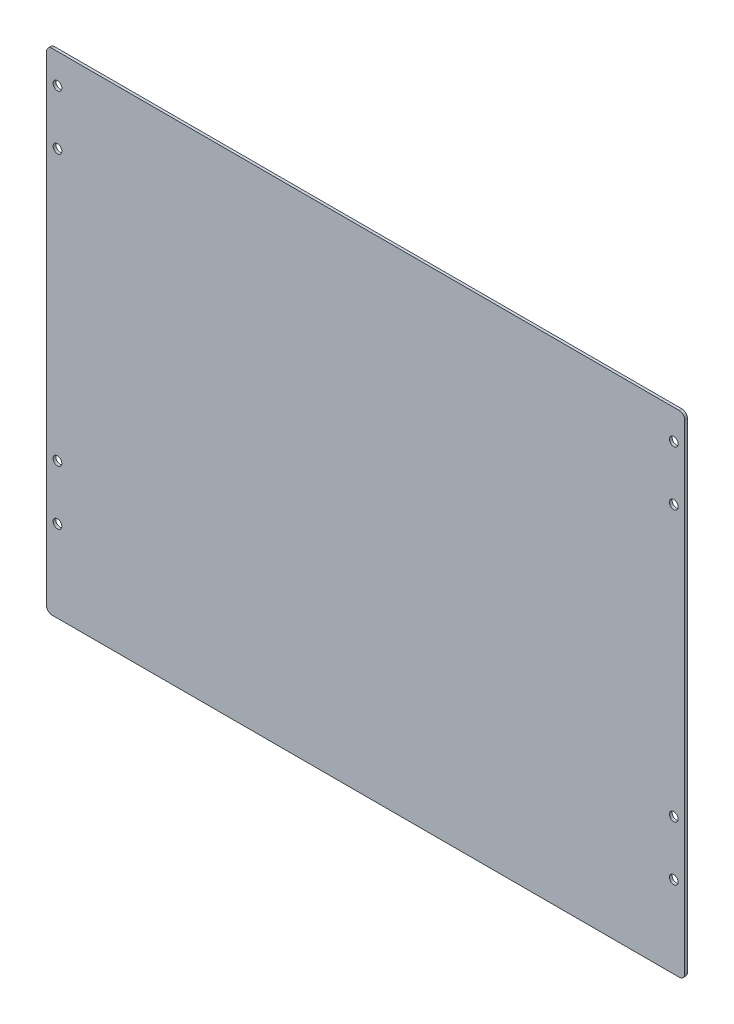
from build123d import *

# Parameters (mm, degrees)
SKETCH_1_W          = 234
SKETCH_1_H          = 180
EXTRUDE_1_DEPTH     = 1
SKETCH_2_R          = 1.6
CUT_EXTRUDE_1_DEPTH = 10
FILLET_1_R          = 2


with BuildPart() as part:
    # 草图1 → 凸台-拉伸1 (new body)
    with BuildSketch(Plane.XY):
        Rectangle(SKETCH_1_W, SKETCH_1_H)
    extrude(amount=EXTRUDE_1_DEPTH)

    # 草图2 → 切除-拉伸1 (cut)
    with BuildSketch(Plane.XY.offset(1)):
        with Locations((-113, -60)):
            Circle(SKETCH_2_R)
        with Locations((-113, -40)):
            Circle(SKETCH_2_R)
        with Locations((-113, 59.12)):
            Circle(SKETCH_2_R)
        with Locations((-113, 79.12)):
            Circle(SKETCH_2_R)
        with Locations((113, -60)):
            Circle(SKETCH_2_R)
        with Locations((113, -40)):
            Circle(SKETCH_2_R)
        with Locations((113, 59.12)):
            Circle(SKETCH_2_R)
        with Locations((113, 79.12)):
            Circle(SKETCH_2_R)
    extrude(amount=-CUT_EXTRUDE_1_DEPTH, mode=Mode.SUBTRACT)

    # 圆角1
    fillet_1_edges = [part.edges().sort_by_distance(p)[0] for p in [
        (117, -90, 0.5),
        (-117, -90, 0.5),
        (-117, 90, 0.5),
        (117, 90, 0.5),
    ]]
    fillet(fillet_1_edges, radius=FILLET_1_R)


solid = part.part
